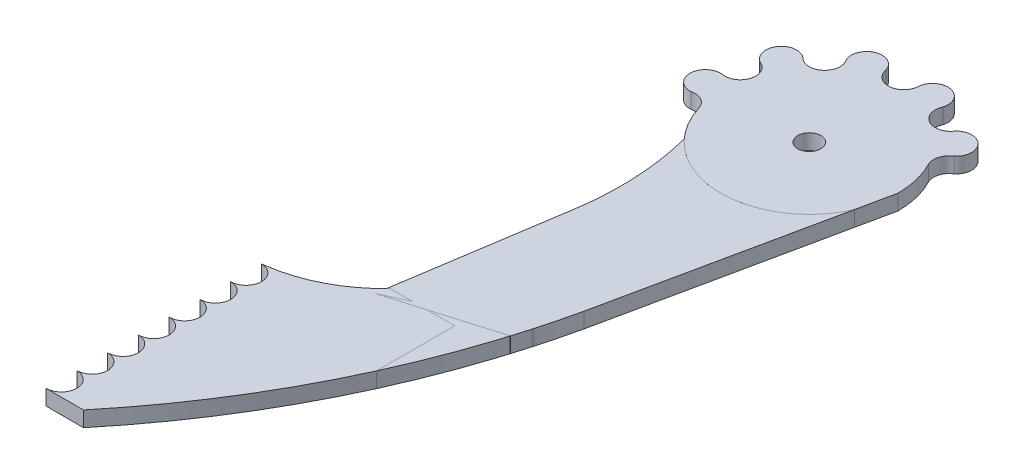
from build123d import *

# Parameters (mm, degrees)
SKETCH1_R           = 1.5
BOSS_EXTRUDE3_DEPTH = 1
BOSS_EXTRUDE5_DEPTH = 1
BOSS_EXTRUDE7_DEPTH = 1
BOSS_EXTRUDE8_DEPTH = 1
CUT_EXTRUDE2_DEPTH  = 1


with BuildPart() as part:
    # Sketch1 → Boss-Extrude3 (new, symmetric)
    with BuildSketch(Plane(origin=(0, 0, 0), x_dir=(1, 0, 0), z_dir=(0, 1, 0))):
        with BuildLine():
            Line((10.514574075, -4.657653059), (11.5, 0))
            ThreePointArc((11.5, 0), (11.182254086, 2.684621677), (10.246575035, 5.220890734))
            ThreePointArc((10.246575035, 5.220890734), (10.1030879, 6.669657352), (10.979881559, 7.831873403))
            ThreePointArc((10.979881559, 7.831873403), (11.149766905, 10.767204742), (8.210294777, 10.699864472))
            ThreePointArc((8.210294777, 10.699864472), (5.575310633, 10.058126632), (4.723206327, 12.632789163))
            ThreePointArc((4.723206327, 12.632789163), (3.222631208, 15.161287811), (0.823354571, 13.461728244))
            ThreePointArc((0.823354571, 13.461728244), (-1.002291042, 11.456239028), (-3.148450543, 13.114240322))
            ThreePointArc((-3.148450543, 13.114240322), (-5.806402198, 14.371349746), (-6.845111027, 11.620692539))
            ThreePointArc((-6.845111027, 11.620692539), (-7.237184497, 8.937178557), (-9.943573918, 9.111606762))
            ThreePointArc((-9.943573918, 9.111606762), (-12.850082375, 8.667490004), (-12.173063031, 5.806253224))
            ThreePointArc((-12.173063031, 5.806253224), (-10.997504694, 3.362274604), (-13.338742224, 1.993488382))
            ThreePointArc((-13.338742224, 1.993488382), (-15.499826972, 0.026307423), (-13.391237031, -1.997040464))
            ThreePointArc((-13.391237031, -1.997040464), (-11.9248669, -2.199836984), (-10.999611474, -3.3553759))
            ThreePointArc((-10.999611474, -3.3553759), (-0.694835786, -11.478989643), (10.514574075, -4.657653059))
        make_face()
        with Locations(Location((0, 0, 0), (0, 0, 270))):
            Circle(SKETCH1_R, mode=Mode.SUBTRACT)
    extrude(amount=BOSS_EXTRUDE3_DEPTH, both=True)


with BuildPart() as body_2:
    # Sketch1<5> → Boss-Extrude5 (new, symmetric)
    with BuildSketch(Plane(origin=(0, 0, 0), x_dir=(1, 0, 0), z_dir=(0, 1, 0))):
        with BuildLine():
            Line((2.806807826, -41.088702969), (10.514574075, -4.657653059))
            ThreePointArc((10.514574075, -4.657653059), (1.846708509, -11.35075626), (-8.495825279, -7.750545324))
            ThreePointArc((-8.495825279, -7.750545324), (-7.347088724, -15.263704681), (-7.738414168, -22.854094893))
            Line((-7.738414168, -22.854094893), (-11.192007229, -45.231550072))
            Line((-11.192007229, -45.231550072), (2.806807826, -41.088702969))
        make_face()
    extrude(amount=BOSS_EXTRUDE5_DEPTH, both=True)


with BuildPart() as body_3:
    # Sketch2 → Boss-Extrude7 (new, symmetric)
    with BuildSketch(Plane(origin=(0, 0, 0), x_dir=(1, 0, 0), z_dir=(0, 1, 0))):
        with BuildLine():
            Line((-2.371433126, -72.667068493), (-2.371433126, -43.697049279))
            Line((-2.371433126, -43.697049279), (-10.753114724, -43.697049279))
            ThreePointArc((-10.753114724, -43.697049279), (-15.600240159, -47.350930238), (-21.380122364, -49.205231385))
            ThreePointArc((-21.380122364, -49.205231385), (-21.632355968, -49.254495275), (-21.888824426, -49.271007455))
            ThreePointArc((-21.888824426, -49.271007455), (-20.474610864, -49.856793893), (-19.888824426, -51.271007455))
            ThreePointArc((-19.888824426, -51.271007455), (-20.474610864, -52.685221018), (-21.888824426, -53.271007455))
            ThreePointArc((-21.888824426, -53.271007455), (-20.474610864, -53.856793893), (-19.888824426, -55.271007455))
            ThreePointArc((-19.888824426, -55.271007455), (-20.474610866, -56.68522102), (-21.888824433, -57.271007455))
            ThreePointArc((-21.888824433, -57.271007455), (-20.474610866, -57.85679389), (-19.888824426, -59.271007455))
            ThreePointArc((-19.888824426, -59.271007455), (-20.474610864, -60.685221018), (-21.888824426, -61.271007455))
            ThreePointArc((-21.888824426, -61.271007455), (-20.474610864, -61.856793893), (-19.888824426, -63.271007455))
            ThreePointArc((-19.888824426, -63.271007455), (-20.474610864, -64.685221018), (-21.888824426, -65.271007455))
            ThreePointArc((-21.888824426, -65.271007455), (-20.474610864, -65.856793893), (-19.888824426, -67.271007455))
            ThreePointArc((-19.888824426, -67.271007455), (-20.474610864, -68.685221018), (-21.888824426, -69.271007455))
            ThreePointArc((-21.888824426, -69.271007455), (-20.474610864, -69.856793893), (-19.888824426, -71.271007455))
            ThreePointArc((-19.888824426, -71.271007455), (-20.474610864, -72.685221018), (-21.888824426, -73.271007455))
            ThreePointArc((-21.888824426, -73.271007455), (-20.474610864, -73.856793893), (-19.888824426, -75.271007455))
            ThreePointArc((-19.888824426, -75.271007455), (-20.474610864, -76.685221018), (-21.888824426, -77.271007455))
            Line((-21.888824426, -77.271007455), (-12.155084024, -77.271007455))
            ThreePointArc((-12.155084024, -77.271007455), (-6.995429189, -75.538191741), (-2.371433126, -72.667068493))
        make_face()
    extrude(amount=BOSS_EXTRUDE7_DEPTH, both=True)


with BuildPart() as body_4:
    # Sketch2<5> → Boss-Extrude8 (new, symmetric)
    with BuildSketch(Plane(origin=(0, 0, 0), x_dir=(1, 0, 0), z_dir=(0, 1, 0))):
        Polygon((-10.753114724, -43.697049279), (-2.371433126, -43.697049279), (-2.371433126, -72.667068493), (3.384279509, -38.732055606), align=None)
    extrude(amount=BOSS_EXTRUDE8_DEPTH, both=True)


with BuildPart() as cut_extrude2_tool:
    # Sketch3 → Cut-Extrude2 (new, symmetric)
    with BuildSketch(Plane(origin=(0, 0, 0), x_dir=(1, 0, 0), z_dir=(0, 1, 0))):
        with BuildLine():
            Line((-17.021954225, -77.271007455), (4.891566987, -77.271007455))
            Line((4.891566987, -77.271007455), (4.891566987, -31.235009619))
            ThreePointArc((4.891566987, -31.235009619), (-3.20178666, -55.616014274), (-17.021954225, -77.271007455))
        make_face()
    extrude(amount=CUT_EXTRUDE2_DEPTH, both=True)


with BuildPart() as body_2_1:
    add(body_2.part)

    # Cut-Extrude2: cut by cut_extrude2_tool
    add(cut_extrude2_tool.part, mode=Mode.SUBTRACT)


with BuildPart() as body_3_1:
    add(body_3.part)

    # Cut-Extrude2: cut by cut_extrude2_tool
    add(cut_extrude2_tool.part, mode=Mode.SUBTRACT)


with BuildPart() as body_4_1:
    add(body_4.part)

    # Cut-Extrude2: cut by cut_extrude2_tool
    add(cut_extrude2_tool.part, mode=Mode.SUBTRACT)


solid = Compound([part.part, body_2_1.part, body_3_1.part, body_4_1.part])
